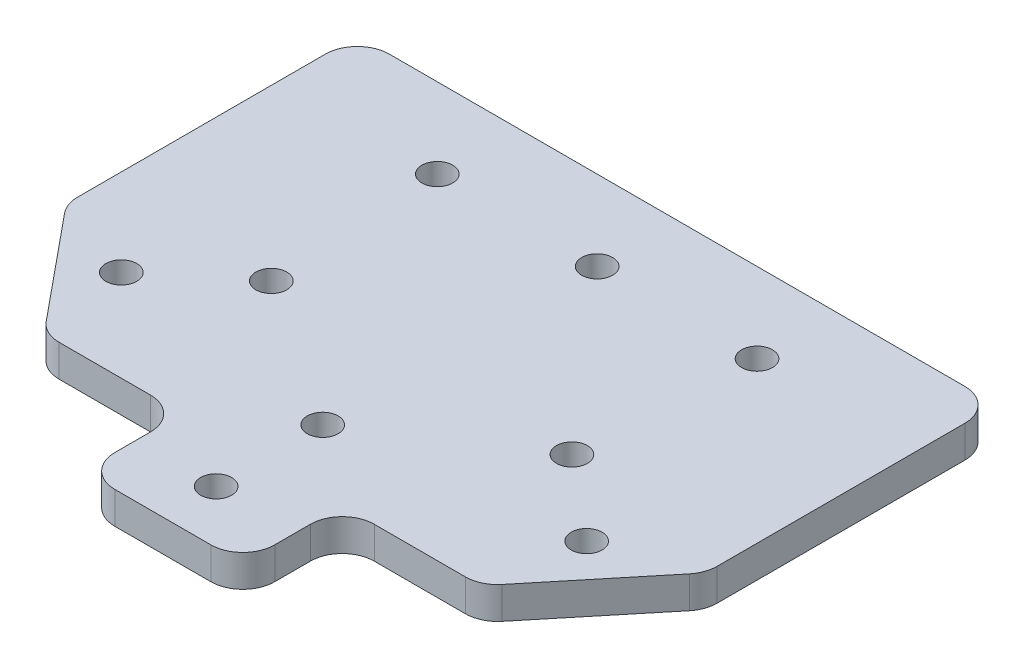
from build123d import *

# Parameters (mm, degrees)
SKETCH_1_R      = 1.45
EXTRUDE_1_DEPTH = 3
FILLET_1_R      = 3


with BuildPart() as part:
    # 草图1 → 凸台-拉伸1 (new body)
    with BuildSketch(Plane(origin=(0, 0, 0), x_dir=(1, 0, 0), z_dir=(0, 1, 0))):
        Polygon((30, 165), (-30, 165), (-30, 137.678611726), (-20.478927243, 126.087702635), (-7.5, 126.087702635), (-7.5, 116.748929431), (7.5, 116.748929431), (7.5, 126.087702635), (20.478927243, 126.087702635), (30, 137.678611726), align=None)
        with Locations(Location((0, 157.5, 0), (0, 0, 270))):
            Circle(SKETCH_1_R, mode=Mode.SUBTRACT)
        with Locations(Location((-15, 157.5, 0), (0, 0, 270))):
            Circle(SKETCH_1_R, mode=Mode.SUBTRACT)
        with Locations(Location((-14.103099985, 141.030854536, 0), (0, 0, 270))):
            Circle(SKETCH_1_R, mode=Mode.SUBTRACT)
        with Locations(Location((-21.830372712, 134.683472697, 0), (0, 0, 270))):
            Circle(SKETCH_1_R, mode=Mode.SUBTRACT)
        with Locations(Location((21.830372712, 134.683472697, 0), (0, 0, 90))):
            Circle(SKETCH_1_R, mode=Mode.SUBTRACT)
        with Locations(Location((14.103099985, 141.030854536, 0), (0, 0, 90))):
            Circle(SKETCH_1_R, mode=Mode.SUBTRACT)
        with Locations(Location((15, 157.5, 0), (0, 0, 90))):
            Circle(SKETCH_1_R, mode=Mode.SUBTRACT)
        with Locations(Location((0, 131.748929431, 0), (0, 0, 270))):
            Circle(SKETCH_1_R, mode=Mode.SUBTRACT)
        with Locations(Location((0, 121.748929431, 0), (0, 0, 270))):
            Circle(SKETCH_1_R, mode=Mode.SUBTRACT)
    extrude(amount=EXTRUDE_1_DEPTH)

    # 圆角1
    fillet_1_edges = [part.edges().sort_by_distance(p)[0] for p in [
        (-30, 1.5, -165),
        (30, 1.5, -165),
        (30, 1.5, -137.678611726),
        (20.478927243, 1.5, -126.087702635),
        (7.5, 1.5, -126.087702635),
        (7.5, 1.5, -116.748929431),
        (-7.5, 1.5, -116.748929431),
        (-7.5, 1.5, -126.087702635),
        (-20.478927243, 1.5, -126.087702635),
        (-30, 1.5, -137.678611726),
    ]]
    fillet(fillet_1_edges, radius=FILLET_1_R)


solid = part.part
